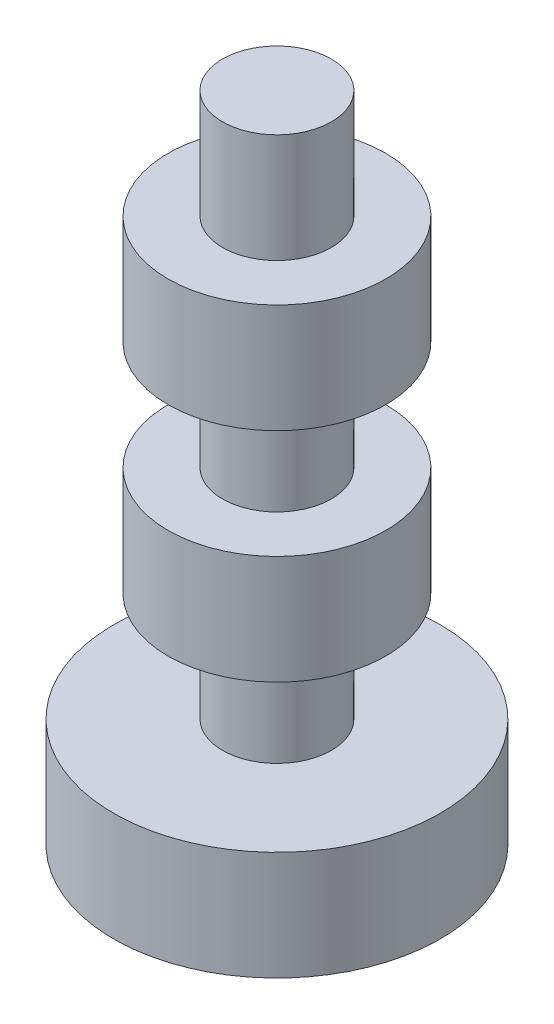
from build123d import *


with BuildPart() as part:
    # Sketch1 → Revolve1 (revolve)
    with BuildSketch(Plane.XY, mode=Mode.PRIVATE) as revolve1_sk:
        Polygon((0, 0), (9.525, 0), (9.525, 6.35), (3.175, 6.35), (3.175, 12.7), (6.35, 12.7), (6.35, 19.05), (3.175, 19.05), (3.175, 25.4), (6.35, 25.4), (6.35, 31.75), (3.175, 31.75), (3.175, 38.1), (0, 38.1), align=None)
    revolve(revolve1_sk.sketch.rotate(Axis((0, 0, 0), (0, 1, 0)), 90), axis=Axis((0, 0, 0), (0, 1, 0)))


solid = part.part
